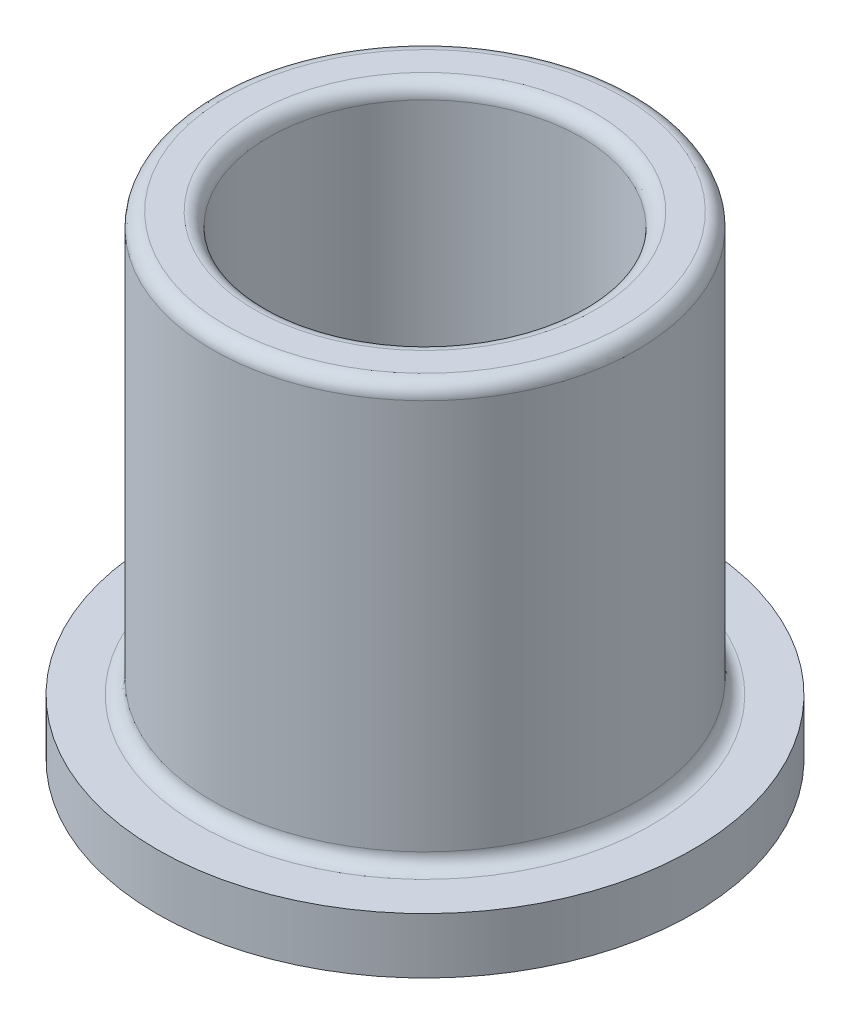
from build123d import *

# Parameters (mm, degrees)
FILLET1_R = 3.175


with BuildPart() as part:
    # Sketch1 → Revolve1 (revolve)
    with BuildSketch(Plane.XY, mode=Mode.PRIVATE) as revolve1_sk:
        Polygon((35.586256664, 107.95), (48.286256664, 107.95), (48.286256664, 12.7), (60.986256664, 12.7), (60.986256664, 0), (35.586256664, 0), align=None)
    revolve(revolve1_sk.sketch.rotate(Axis((0, 107.95, 0), (0, -1, 0)), 90), axis=Axis((0, 107.95, 0), (0, -1, 0)))

    # Fillet1
    fillet1_edges = [part.edges().sort_by_distance(p)[0] for p in [
        (0, 107.95, -35.586256664),
        (0, 107.95, -48.286256664),
        (0, 12.7, -48.286256664),
    ]]
    fillet(fillet1_edges, radius=FILLET1_R)


solid = part.part
